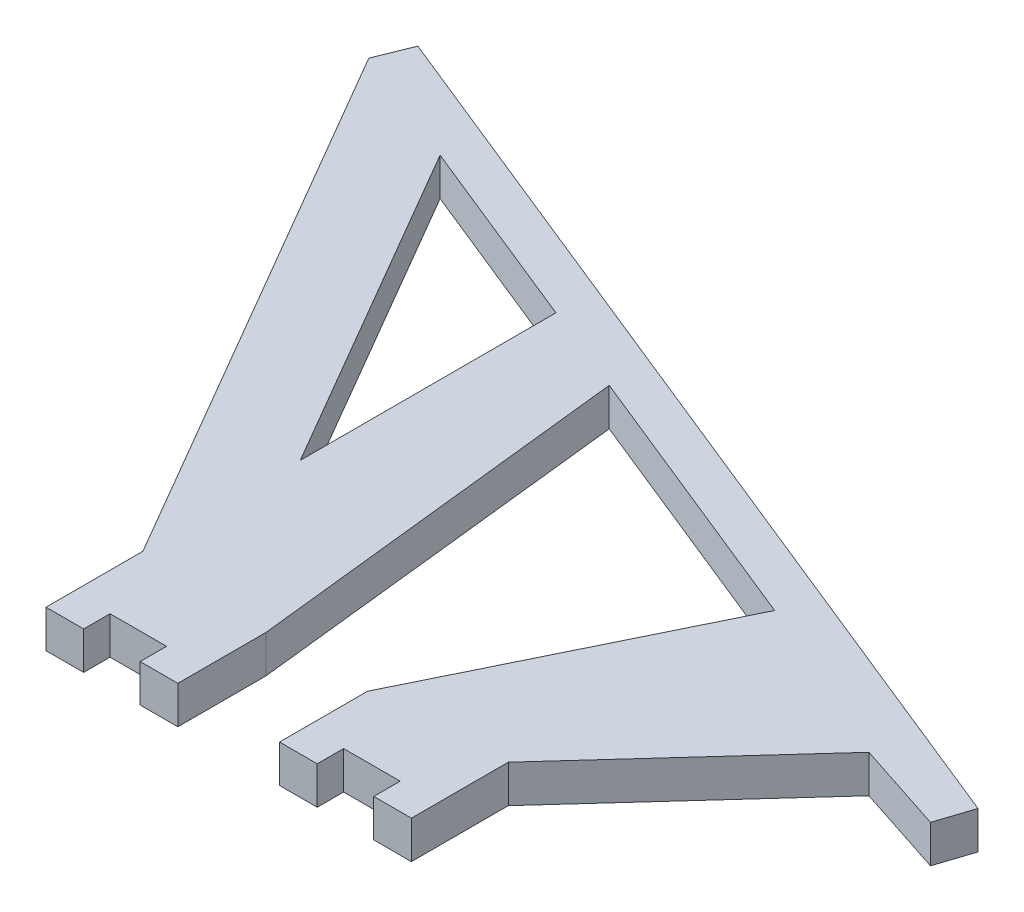
from build123d import *

# Parameters (mm, degrees)
BOSS_EXTRUDE1_DEPTH = 10


with BuildPart() as part:
    # Sketch1 → Boss-Extrude1 (new body)
    with BuildSketch(Plane(origin=(0, 0, 0), x_dir=(1, 0, 0), z_dir=(0, 1, 0))):
        Polygon((13.5, 3.125985755), (13.5, -3.125985755), (13.5, -10.128193845), (23.5, -10.128193845), (23.5, -3.125985755), (38.5, -3.125985755), (38.5, -10.128193845), (48.5, -10.128193845), (48.5, -3.125985755), (48.5, 15.603410537), (94.082583098, 65.745372538), (118.364573122, 57.800903455), (121.474127931, 67.305148238), (-128.125479481, 168.208510016), (-131.873415704, 158.937427336), (-48.5, 15.603410537), (-48.5, -3.125985755), (-48.5, -10.128193845), (-38.5, -10.128193845), (-38.5, -3.125985755), (-23.5, -3.125985755), (-23.5, -10.128193845), (-13.5, -10.128193845), (-13.5, -3.125985755), (-13.5, 3.125985755), (-13.5, 13.214699594), (-24.737103286, 115.626405321), (48.971306344, 85.828977352), (13.5, 13.214699594), align=None)
        Polygon((-98.688732225, 145.522157347), (-48.5, 125.232815319), (-48.5, 57.36957732), (-100.110149338, 146.096780708), align=None, mode=Mode.SUBTRACT)
    extrude(amount=BOSS_EXTRUDE1_DEPTH)


solid = part.part
